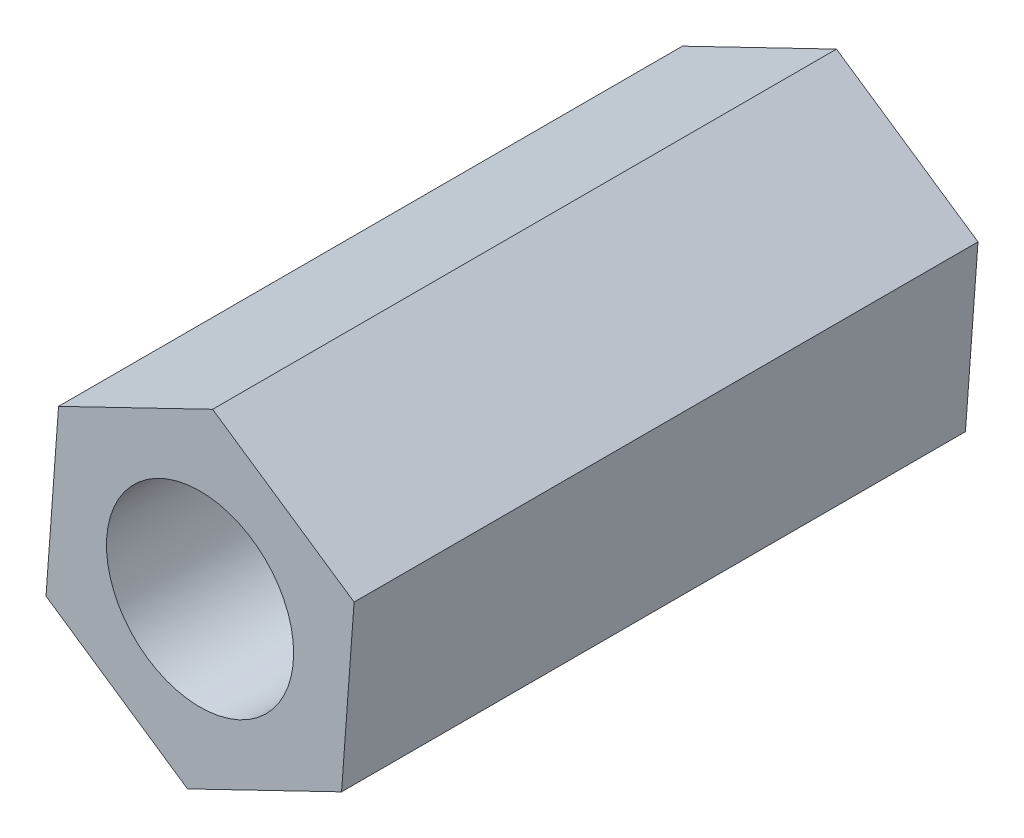
from build123d import *

# Parameters (mm, degrees)
EXTRUDE_1_DEPTH     = 40
SKETCH_4_R          = 6
CUT_EXTRUDE_1_DEPTH = 43.628999189


with BuildPart() as part:
    # 스케치3 → 보스-돌출1 (new body)
    with BuildSketch(Plane.XY):
        Polygon((9.07241663, -6.166408178), (9.876474448, 4.773739186), (0.804057817, 10.940147365), (-9.07241663, 6.166408178), (-9.876474448, -4.773739186), (-0.804057817, -10.940147365), align=None)
    extrude(amount=-EXTRUDE_1_DEPTH)

    # 스케치4 → 컷-돌출1 (cut, through all)
    with BuildSketch(Plane.XY):
        Circle(SKETCH_4_R)
    extrude(amount=-CUT_EXTRUDE_1_DEPTH, mode=Mode.SUBTRACT)


solid = part.part
